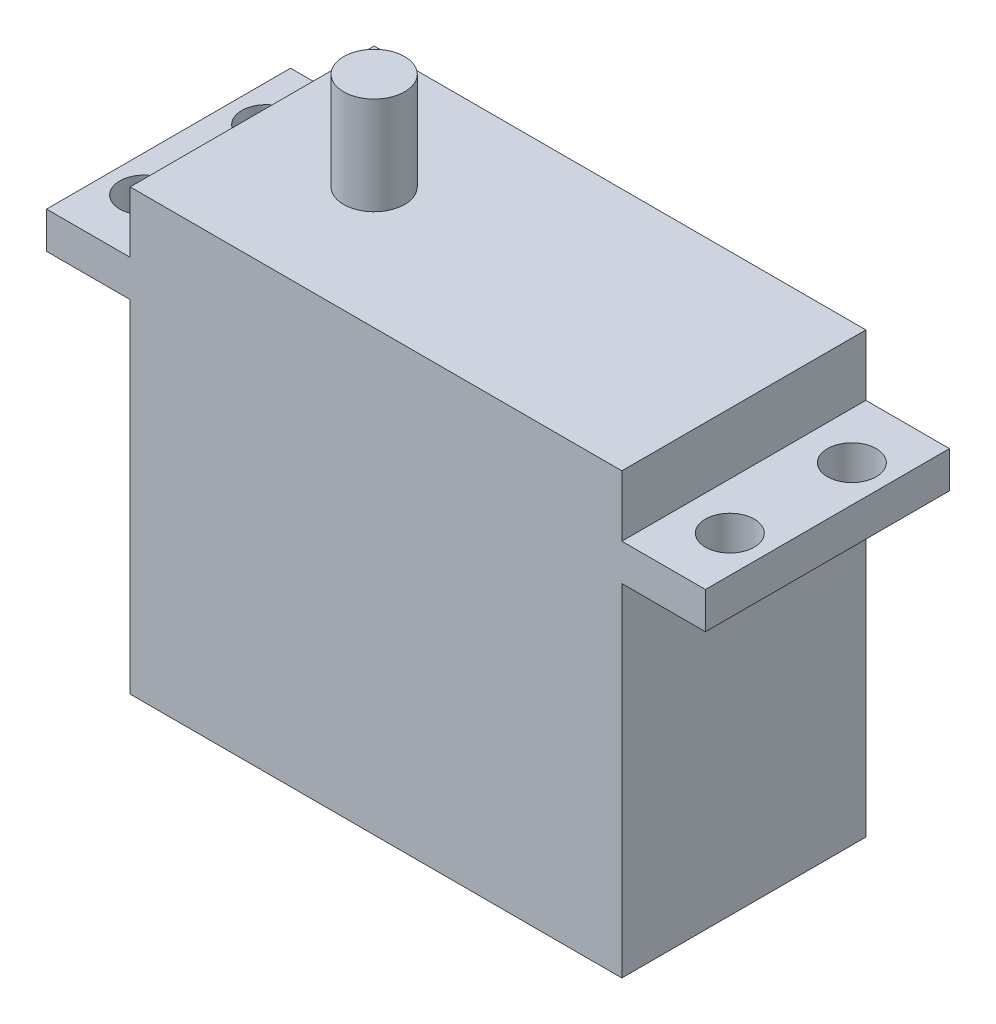
from build123d import *

# Parameters (mm, degrees)
SKETCH1_W           = 40.3
SKETCH1_H           = 20
BOSS_EXTRUDE1_DEPTH = 28
SKETCH2_R           = 2
BOSS_EXTRUDE2_DEPTH = 3
SKETCH3_W           = 40.3
SKETCH3_H           = 20
BOSS_EXTRUDE3_DEPTH = 8
SKETCH4_R           = 2.5
BOSS_EXTRUDE4_DEPTH = 8


with BuildPart() as part:
    # Sketch1 → Boss-Extrude1 (new body)
    with BuildSketch(Plane(origin=(0, 0, 0), x_dir=(1, 0, 0), z_dir=(0, 1, 0))):
        with Locations((20.15, -10)):
            Rectangle(SKETCH1_W, SKETCH1_H)
    extrude(amount=BOSS_EXTRUDE1_DEPTH)

    # Sketch2 → Boss-Extrude2 (add)
    with BuildSketch(Plane(origin=(0, 28, 0), x_dir=(1, 0, 0), z_dir=(0, 1, 0))):
        Polygon((20.15, 0), (-6.85, 0), (-6.85, -20), (20.15, -20), (47.15, -20), (47.15, 0), align=None)
        with Locations(Location((-3.85, -5, 0), (0, 0, 270))):
            Circle(SKETCH2_R, mode=Mode.SUBTRACT)
        with Locations(Location((-3.85, -15, 0), (0, 0, 270))):
            Circle(SKETCH2_R, mode=Mode.SUBTRACT)
        with Locations(Location((44.15, -5, 0), (0, 0, 270))):
            Circle(SKETCH2_R, mode=Mode.SUBTRACT)
        with Locations(Location((44.15, -15, 0), (0, 0, 270))):
            Circle(SKETCH2_R, mode=Mode.SUBTRACT)
    extrude(amount=BOSS_EXTRUDE2_DEPTH)

    # Sketch3 → Boss-Extrude3 (add)
    with BuildSketch(Plane(origin=(0, 28, 0), x_dir=(1, 0, 0), z_dir=(0, 1, 0))):
        with Locations((20.15, -10)):
            Rectangle(SKETCH3_W, SKETCH3_H)
    extrude(amount=BOSS_EXTRUDE3_DEPTH)

    # Sketch4 → Boss-Extrude4 (add)
    with BuildSketch(Plane(origin=(0, 36, 0), x_dir=(1, 0, 0), z_dir=(0, 1, 0))):
        with Locations(Location((10, -10, 0), (0, 0, 270))):
            Circle(SKETCH4_R)
    extrude(amount=BOSS_EXTRUDE4_DEPTH)


solid = part.part
